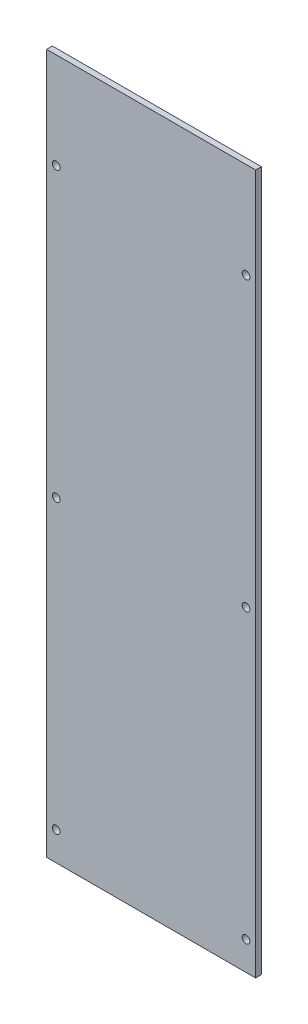
from build123d import *

# Parameters (mm, degrees)
SKETCH2_W           = 109
SKETCH2_H           = 365
SKETCH2_R           = 2
BOSS_EXTRUDE1_DEPTH = 3


with BuildPart() as part:
    # Sketch2 → Boss-Extrude1 (new body)
    with BuildSketch(Plane.XY):
        with Locations((0, 2.5)):
            Rectangle(SKETCH2_W, SKETCH2_H)
        with Locations((-49.5, -165)):
            Circle(SKETCH2_R, mode=Mode.SUBTRACT)
        with Locations((49.5, -165)):
            Circle(SKETCH2_R, mode=Mode.SUBTRACT)
        with Locations((-49.5, -15)):
            Circle(SKETCH2_R, mode=Mode.SUBTRACT)
        with Locations((49.5, -15)):
            Circle(SKETCH2_R, mode=Mode.SUBTRACT)
        with Locations((-49.5, 135)):
            Circle(SKETCH2_R, mode=Mode.SUBTRACT)
        with Locations((49.5, 135)):
            Circle(SKETCH2_R, mode=Mode.SUBTRACT)
    extrude(amount=BOSS_EXTRUDE1_DEPTH)


solid = part.part
